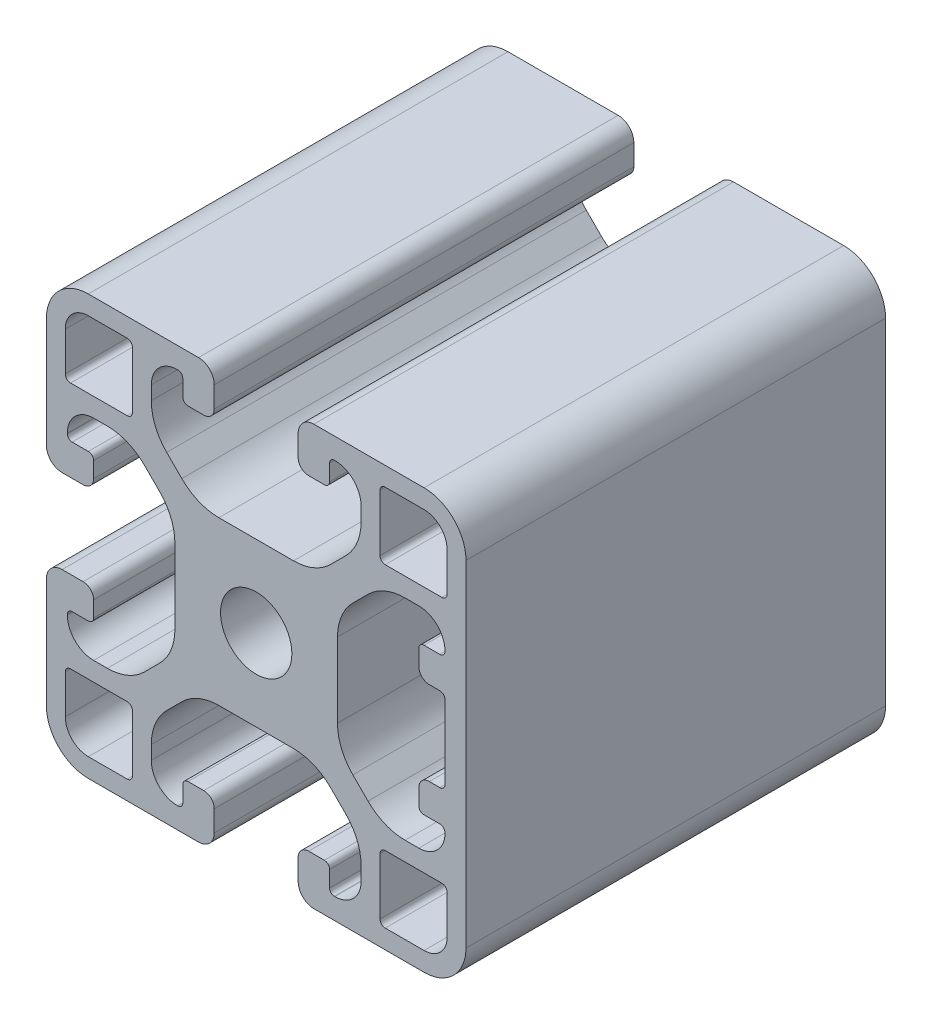
from build123d import *

# Parameters (mm, degrees)
SCHIZZO1_R                   = 3.4
ESTRUSIONE_ESTRUSIONE1_DEPTH = 40


with BuildPart() as part:
    # Schizzo1 → Estrusione-Estrusione1 (new body)
    with BuildSketch(Plane(origin=(0, 0, -340), x_dir=(-1, 0, 0), z_dir=(0, 0, -1))):
        with BuildLine():
            Line((6.5, -15.5), (5, -15.5))
            ThreePointArc((5, -15.5), (4.292893219, -15.792893219), (4, -16.5))
            Line((4, -16.5), (4, -18.5))
            ThreePointArc((4, -18.5), (4.439339828, -19.560660172), (5.5, -20))
            Line((5.5, -20), (16, -20))
            ThreePointArc((16, -20), (18.828427125, -18.828427125), (20, -16))
            Line((20, -16), (20, -5.5))
            ThreePointArc((20, -5.5), (19.560660172, -4.439339828), (18.5, -4))
            Line((18.5, -4), (16.5, -4))
            ThreePointArc((16.5, -4), (15.792893219, -4.292893219), (15.5, -5))
            Line((15.5, -5), (15.5, -6.5))
            ThreePointArc((15.5, -6.5), (15.646446609, -6.853553391), (16, -7))
            Line((16, -7), (17.55, -7))
            ThreePointArc((17.55, -7), (17.868198052, -7.131801948), (18, -7.45))
            Line((18, -7.45), (18, -7.5))
            ThreePointArc((18, -7.5), (17.267766953, -9.267766953), (15.5, -10))
            Line((15.5, -10), (14.192388155, -10))
            ThreePointArc((14.192388155, -10), (12.278970994, -9.619397663), (10.656854249, -8.535533906))
            Line((10.656854249, -8.535533906), (9.214466094, -7.09314575))
            ThreePointArc((9.214466094, -7.09314575), (8.130602337, -5.471029006), (7.75, -3.557611845))
            Line((7.75, -3.557611845), (7.75, 3.557611845))
            ThreePointArc((7.75, 3.557611845), (8.130602337, 5.471029006), (9.214466094, 7.09314575))
            Line((9.214466094, 7.09314575), (10.656854249, 8.535533906))
            ThreePointArc((10.656854249, 8.535533906), (12.278970994, 9.619397663), (14.192388155, 10))
            Line((14.192388155, 10), (15.5, 10))
            ThreePointArc((15.5, 10), (17.267766953, 9.267766953), (18, 7.5))
            Line((18, 7.5), (18, 7.45))
            ThreePointArc((18, 7.45), (17.868198052, 7.131801948), (17.55, 7))
            Line((17.55, 7), (16, 7))
            ThreePointArc((16, 7), (15.646446609, 6.853553391), (15.5, 6.5))
            Line((15.5, 6.5), (15.5, 5))
            ThreePointArc((15.5, 5), (15.792893219, 4.292893219), (16.5, 4))
            Line((16.5, 4), (18.5, 4))
            ThreePointArc((18.5, 4), (19.560660172, 4.439339828), (20, 5.5))
            Line((20, 5.5), (20, 16))
            ThreePointArc((20, 16), (18.828427125, 18.828427125), (16, 20))
            Line((16, 20), (5.5, 20))
            ThreePointArc((5.5, 20), (4.439339828, 19.560660172), (4, 18.5))
            Line((4, 18.5), (4, 16.5))
            ThreePointArc((4, 16.5), (4.292893219, 15.792893219), (5, 15.5))
            Line((5, 15.5), (6.5, 15.5))
            ThreePointArc((6.5, 15.5), (6.853553391, 15.646446609), (7, 16))
            Line((7, 16), (7, 17.55))
            ThreePointArc((7, 17.55), (7.131801948, 17.868198052), (7.45, 18))
            Line((7.45, 18), (7.5, 18))
            ThreePointArc((7.5, 18), (9.267766953, 17.267766953), (10, 15.5))
            Line((10, 15.5), (10, 14.192388155))
            ThreePointArc((10, 14.192388155), (9.619397663, 12.278970994), (8.535533906, 10.656854249))
            Line((8.535533906, 10.656854249), (7.09314575, 9.214466094))
            ThreePointArc((7.09314575, 9.214466094), (5.471029006, 8.130602337), (3.557611844, 7.75))
            Line((3.557611844, 7.75), (-3.557611845, 7.75))
            ThreePointArc((-3.557611845, 7.75), (-5.471029006, 8.130602337), (-7.09314575, 9.214466094))
            Line((-7.09314575, 9.214466094), (-8.535533906, 10.656854249))
            ThreePointArc((-8.535533906, 10.656854249), (-9.619397663, 12.278970994), (-10, 14.192388155))
            Line((-10, 14.192388155), (-10, 15.5))
            ThreePointArc((-10, 15.5), (-9.267766953, 17.267766953), (-7.5, 18))
            Line((-7.5, 18), (-7.45, 18))
            ThreePointArc((-7.45, 18), (-7.131801948, 17.868198052), (-7, 17.55))
            Line((-7, 17.55), (-7, 16))
            ThreePointArc((-7, 16), (-6.853553391, 15.646446609), (-6.5, 15.5))
            Line((-6.5, 15.5), (-5, 15.5))
            ThreePointArc((-5, 15.5), (-4.292893219, 15.792893219), (-4, 16.5))
            Line((-4, 16.5), (-4, 18.5))
            ThreePointArc((-4, 18.5), (-4.439339828, 19.560660172), (-5.5, 20))
            Line((-5.5, 20), (-16, 20))
            ThreePointArc((-16, 20), (-18.828427125, 18.828427125), (-20, 16))
            Line((-20, 16), (-20, -16))
            ThreePointArc((-20, -16), (-18.828427125, -18.828427125), (-16, -20))
            Line((-16, -20), (-5.5, -20))
            ThreePointArc((-5.5, -20), (-4.439339828, -19.560660172), (-4, -18.5))
            Line((-4, -18.5), (-4, -16.5))
            ThreePointArc((-4, -16.5), (-4.292893219, -15.792893219), (-5, -15.5))
            Line((-5, -15.5), (-6.5, -15.5))
            ThreePointArc((-6.5, -15.5), (-6.853553391, -15.646446609), (-7, -16))
            Line((-7, -16), (-7, -17.55))
            ThreePointArc((-7, -17.55), (-7.131801948, -17.868198052), (-7.45, -18))
            Line((-7.45, -18), (-7.5, -18))
            ThreePointArc((-7.5, -18), (-9.267766953, -17.267766953), (-10, -15.5))
            Line((-10, -15.5), (-10, -14.192388155))
            ThreePointArc((-10, -14.192388155), (-9.619397663, -12.278970994), (-8.535533906, -10.656854249))
            Line((-8.535533906, -10.656854249), (-7.09314575, -9.214466094))
            ThreePointArc((-7.09314575, -9.214466094), (-5.471029006, -8.130602337), (-3.557611845, -7.75))
            Line((-3.557611845, -7.75), (3.557611845, -7.75))
            ThreePointArc((3.557611845, -7.75), (5.471029006, -8.130602337), (7.09314575, -9.214466094))
            Line((7.09314575, -9.214466094), (8.535533906, -10.656854249))
            ThreePointArc((8.535533906, -10.656854249), (9.619397663, -12.278970994), (10, -14.192388155))
            Line((10, -14.192388155), (10, -15.5))
            ThreePointArc((10, -15.5), (9.267766953, -17.267766953), (7.5, -18))
            Line((7.5, -18), (7.45, -18))
            ThreePointArc((7.45, -18), (7.131801948, -17.868198052), (7, -17.55))
            Line((7, -17.55), (7, -16))
            ThreePointArc((7, -16), (6.853553391, -15.646446609), (6.5, -15.5))
        make_face()
        with Locations(Location((0, 0, 0), (0, 0, 180))):
            Circle(SCHIZZO1_R, mode=Mode.SUBTRACT)
        with BuildLine():
            Line((-12.3, -18.2), (-16, -18.2))
            ThreePointArc((-16, -18.2), (-17.555634919, -17.555634919), (-18.2, -16))
            Line((-18.2, -16), (-18.2, -12.3))
            ThreePointArc((-18.2, -12.3), (-18.053553391, -11.946446609), (-17.7, -11.8))
            Line((-17.7, -11.8), (-12.3, -11.8))
            ThreePointArc((-12.3, -11.8), (-11.946446609, -11.946446609), (-11.8, -12.3))
            Line((-11.8, -12.3), (-11.8, -17.7))
            ThreePointArc((-11.8, -17.7), (-11.946446609, -18.053553391), (-12.3, -18.2))
        make_face(mode=Mode.SUBTRACT)
        with BuildLine():
            Line((-11.8, 17.7), (-11.8, 12.3))
            ThreePointArc((-11.8, 12.3), (-11.946446609, 11.946446609), (-12.3, 11.8))
            Line((-12.3, 11.8), (-17.7, 11.8))
            ThreePointArc((-17.7, 11.8), (-18.053553391, 11.946446609), (-18.2, 12.3))
            Line((-18.2, 12.3), (-18.2, 16))
            ThreePointArc((-18.2, 16), (-17.555634919, 17.555634919), (-16, 18.2))
            Line((-16, 18.2), (-12.3, 18.2))
            ThreePointArc((-12.3, 18.2), (-11.946446609, 18.053553391), (-11.8, 17.7))
        make_face(mode=Mode.SUBTRACT)
        with BuildLine():
            Line((18.2, 16), (18.2, 12.3))
            ThreePointArc((18.2, 12.3), (18.053553391, 11.946446609), (17.7, 11.8))
            Line((17.7, 11.8), (12.3, 11.8))
            ThreePointArc((12.3, 11.8), (11.946446609, 11.946446609), (11.8, 12.3))
            Line((11.8, 12.3), (11.8, 17.7))
            ThreePointArc((11.8, 17.7), (11.946446609, 18.053553391), (12.3, 18.2))
            Line((12.3, 18.2), (16, 18.2))
            ThreePointArc((16, 18.2), (17.555634919, 17.555634919), (18.2, 16))
        make_face(mode=Mode.SUBTRACT)
        with BuildLine():
            Line((18.2, -12.3), (18.2, -16))
            ThreePointArc((18.2, -16), (17.555634919, -17.555634919), (16, -18.2))
            Line((16, -18.2), (12.3, -18.2))
            ThreePointArc((12.3, -18.2), (11.946446609, -18.053553391), (11.8, -17.7))
            Line((11.8, -17.7), (11.8, -12.3))
            ThreePointArc((11.8, -12.3), (11.946446609, -11.946446609), (12.3, -11.8))
            Line((12.3, -11.8), (17.7, -11.8))
            ThreePointArc((17.7, -11.8), (18.053553391, -11.946446609), (18.2, -12.3))
        make_face(mode=Mode.SUBTRACT)
        with BuildLine():
            Line((-16, 7), (-17.5, 7))
            ThreePointArc((-17.5, 7), (-17.853553391, 7.146446609), (-18, 7.5))
            ThreePointArc((-18, 7.5), (-17.267766953, 9.267766953), (-15.5, 10))
            Line((-15.5, 10), (-14.192388155, 10))
            ThreePointArc((-14.192388155, 10), (-12.278970994, 9.619397663), (-10.656854249, 8.535533906))
            Line((-10.656854249, 8.535533906), (-9.214466094, 7.093145751))
            ThreePointArc((-9.214466094, 7.093145751), (-8.130602337, 5.471029006), (-7.75, 3.557611845))
            Line((-7.75, 3.557611845), (-7.75, -3.557611845))
            ThreePointArc((-7.75, -3.557611845), (-8.130602337, -5.471029006), (-9.214466094, -7.093145751))
            Line((-9.214466094, -7.093145751), (-10.656854249, -8.535533906))
            ThreePointArc((-10.656854249, -8.535533906), (-12.278970994, -9.619397663), (-14.192388155, -10))
            Line((-14.192388155, -10), (-15.5, -10))
            ThreePointArc((-15.5, -10), (-17.267766953, -9.267766953), (-18, -7.5))
            ThreePointArc((-18, -7.5), (-17.853553391, -7.146446609), (-17.5, -7))
            Line((-17.5, -7), (-16, -7))
            ThreePointArc((-16, -7), (-15.646446609, -6.853553391), (-15.5, -6.5))
            Line((-15.5, -6.5), (-15.5, -5))
            ThreePointArc((-15.5, -5), (-15.792893219, -4.292893219), (-16.5, -4))
            Line((-16.5, -4), (-17.5, -4))
            ThreePointArc((-17.5, -4), (-17.853553391, -3.853553391), (-18, -3.5))
            Line((-18, -3.5), (-18, 3.5))
            ThreePointArc((-18, 3.5), (-17.853553391, 3.853553391), (-17.5, 4))
            Line((-17.5, 4), (-16.5, 4))
            ThreePointArc((-16.5, 4), (-15.792893219, 4.292893219), (-15.5, 5))
            Line((-15.5, 5), (-15.5, 6.5))
            ThreePointArc((-15.5, 6.5), (-15.646446609, 6.853553391), (-16, 7))
        make_face(mode=Mode.SUBTRACT)
    extrude(amount=-ESTRUSIONE_ESTRUSIONE1_DEPTH)


solid = part.part
